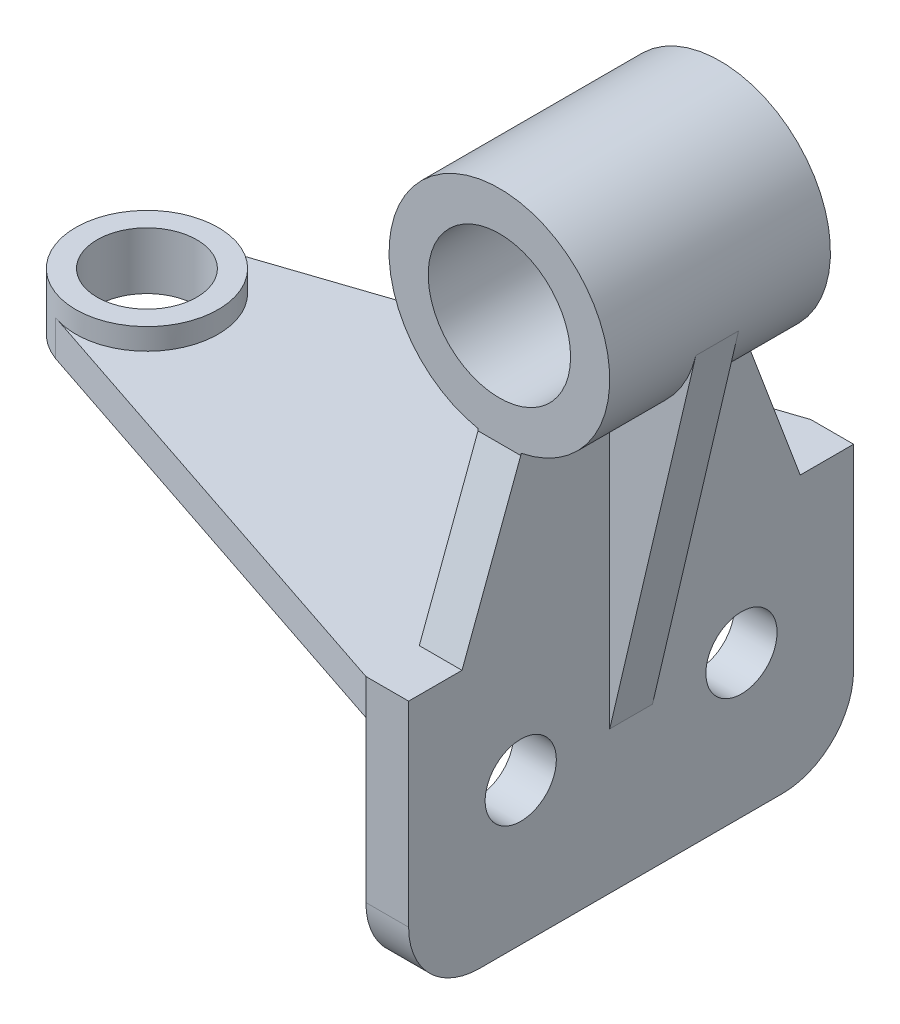
from build123d import *
from build123d.topology import SkipClean

# Parameters (mm, degrees)
BOSS_EXTRUDE1_DEPTH      = 10
SKETCH2_R                = 20
BOSS_EXTRUDE2_DEPTH      = 6
CUT_EXTRUDE1_REACH       = 170.814
SKETCH3_R                = 14
BOSS_EXTRUDE3_DEPTH      = 31
BOSS_EXTRUDE3_DEPTH_BACK = 31
SKETCH4_R                = 31
SKETCH4_R_2              = 20
BOSS_EXTRUDE4_DEPTH      = 12
SKETCH7_R                = 10
BOSS_EXTRUDE5_DEPTH      = 12
BOSS_EXTRUDE6_DEPTH      = 6
BOSS_EXTRUDE6_DEPTH_BACK = 6


with BuildPart() as part:
    # Sketch1 → Boss-Extrude1 (new body)
    with BuildSketch(Plane(origin=(0, 0, 0), x_dir=(1, 0, 0), z_dir=(0, 1, 0))):
        with BuildLine():
            Line((0, 0), (0, -62.5))
            Line((0, -62.5), (-12, -62.5))
            Line((-12, -62.5), (-142.957379404, -18.750863229))
            ThreePointArc((-142.957379404, -18.750863229), (-155.997283991, 0.329595189), (-142.335664896, 18.969959154))
            Line((-142.335664896, 18.969959154), (-12, 62.5))
            Line((-12, 62.5), (0, 62.5))
            Line((0, 62.5), (0, 0))
        make_face()
    extrude(amount=BOSS_EXTRUDE1_DEPTH)

    # Sketch2 → Boss-Extrude2 (add)
    with SkipClean():  # the faces are left unmerged after this step: merging them gives an invalid solid
        with BuildSketch(Plane(origin=(0, 10, 0), x_dir=(1, 0, 0), z_dir=(0, 1, 0))):
            with Locations((-136, 0)):
                Circle(SKETCH2_R)
        extrude(amount=BOSS_EXTRUDE2_DEPTH)

    # Sketch3 → Cut-Extrude1 (cut, up to next)
    with BuildSketch(Plane(origin=(0, 16, 0), x_dir=(1, 0, 0), z_dir=(0, 1, 0)), mode=Mode.PRIVATE) as cut_extrude1_sk1:
        with Locations((-136, 0)):
            Circle(SKETCH3_R)
    cut_extrude1_tool1 = extrude(cut_extrude1_sk1.sketch, amount=-CUT_EXTRUDE1_REACH, mode=Mode.PRIVATE) & part.part
    add(cut_extrude1_tool1.solids().sort_by_distance((-136, 16, 0))[0], mode=Mode.SUBTRACT)

    # Sketch5 → Boss-Extrude4 (add)
    with SkipClean():  # the faces are left unmerged after this step: merging them gives an invalid solid
        with BuildSketch(Plane(origin=(0, 0, 0), x_dir=(0, 0, -1), z_dir=(1, 0, 0))):
            Polygon((-47.5, 10), (-31, 54), (-31, 60.618293766), (31, 60.618293766), (31, 54), (47.5, 10), align=None)
        extrude(amount=-BOSS_EXTRUDE4_DEPTH)

    # Sketch7 → Boss-Extrude5 (add)
    with SkipClean():  # the faces are left unmerged after this step: merging them gives an invalid solid
        with BuildSketch(Plane(origin=(0, 0, 0), x_dir=(0, 0, -1), z_dir=(1, 0, 0))):
            with BuildLine():
                Line((-62.5, 0), (-62.5, -45))
                ThreePointArc((-62.5, -45), (-56.642135624, -59.142135624), (-42.5, -65))
                Line((-42.5, -65), (42.5, -65))
                ThreePointArc((42.5, -65), (56.642135624, -59.142135624), (62.5, -45))
                Line((62.5, -45), (62.5, 0))
                Line((62.5, 0), (-62.5, 0))
            make_face()
            with Locations((-31, -25)):
                Circle(SKETCH7_R, mode=Mode.SUBTRACT)
            with Locations((31, -25)):
                Circle(SKETCH7_R, mode=Mode.SUBTRACT)
        extrude(amount=-BOSS_EXTRUDE5_DEPTH)



with BuildPart() as body_2:
    # Sketch4 → Boss-Extrude3 (new, two sides: drawn at the far end of the back side and taken through both)
    with BuildSketch(Plane.XY.offset(-BOSS_EXTRUDE3_DEPTH_BACK)):
        with Locations((-6, 85)):
            Circle(SKETCH4_R)
        with Locations((-6, 85)):
            Circle(SKETCH4_R_2, mode=Mode.SUBTRACT)
    extrude(amount=BOSS_EXTRUDE3_DEPTH + BOSS_EXTRUDE3_DEPTH_BACK)


with BuildPart() as part_1:
    with SkipClean():  # the faces are left unmerged after this step: merging them gives an invalid solid
        add(part.part)

        add(body_2.part)  # Boss-Extrude6 merges body 2
        # Sketch8 → Boss-Extrude6 (add, two sides: drawn at the far end of the back side and taken through both)
        with BuildSketch(Plane.XY.offset(-BOSS_EXTRUDE6_DEPTH_BACK)):
            with BuildLine():
                Line((0, -25), (24.178270058, 77.909723821))
                ThreePointArc((24.178270058, 77.909723821), (15.52239867, 62.688873729), (0, 54.586187349))
                Line((0, 54.586187349), (0, -25))
            make_face()
        extrude(amount=BOSS_EXTRUDE6_DEPTH + BOSS_EXTRUDE6_DEPTH_BACK)


solid = part_1.part
